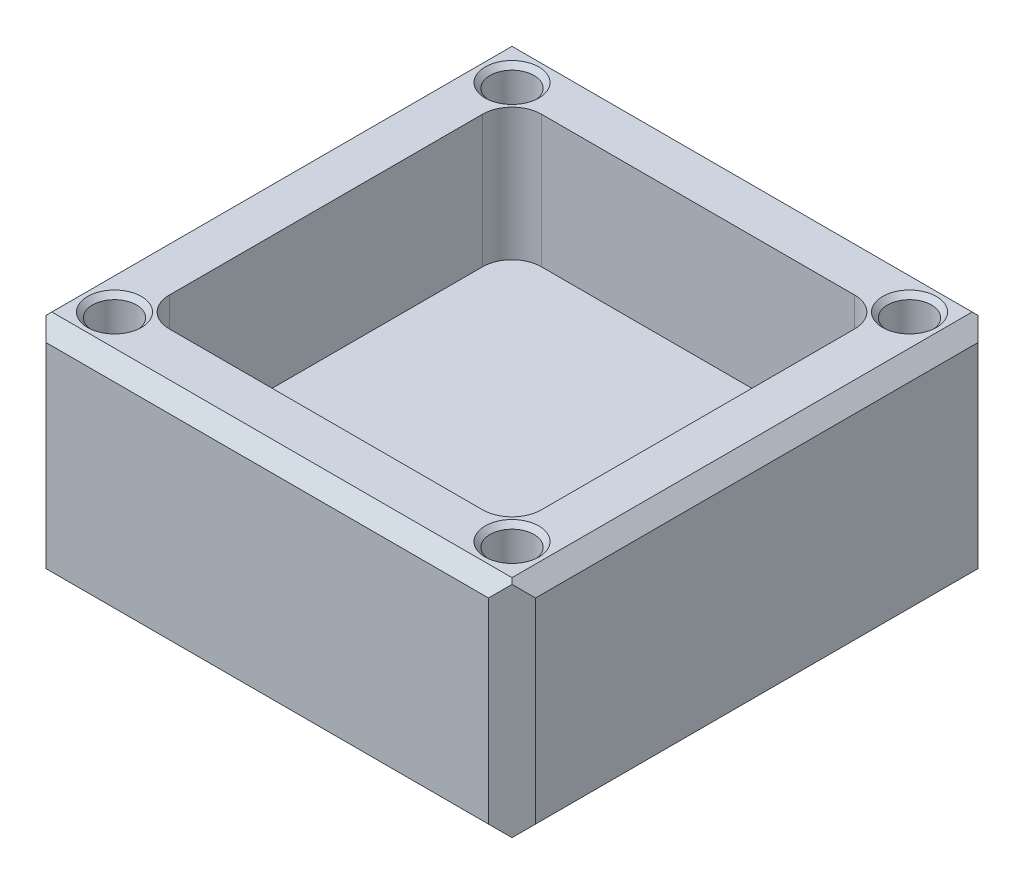
from build123d import *

# Parameters (mm, degrees)
BOSS_EXTRUDE1_DEPTH                          = 50
CUT_EXTRUDE1_DEPTH                           = 50
CUT_EXTRUDE2_DEPTH                           = 13.5
SKETCH4_R                                    = 2.25
CUT_EXTRUDE3_DEPTH                           = 18
CSK_FOR_M2_5_COUNTERSUNK_FLAT_HEAD_S_2_COUNT = 2
CSK_FOR_M2_5_COUNTERSUNK_FLAT_HEAD_S_2_PITCH = 40.6
CSK_FOR_M2_5_COUNTERSUNK_FLAT_HEAD_S_3_COUNT = 2
CSK_FOR_M2_5_COUNTERSUNK_FLAT_HEAD_S_3_PITCH = 57.417070632
CSK_FOR_M2_5_COUNTERSUNK_FLAT_HEAD_S_4_COUNT = 2
CSK_FOR_M2_5_COUNTERSUNK_FLAT_HEAD_S_4_PITCH = 40.6
CUT_EXTRUDE4_DEPTH                           = 76
SKETCH8_W                                    = 0.314102564
SKETCH8_H                                    = 3.58974359
SKETCH8_H_2                                  = 2.557692308
CUT_EXTRUDE5_DEPTH                           = 1


with BuildPart() as part:
    # Sketch1 → Boss-Extrude1 (new body)
    with BuildSketch(Plane.XY):
        Polygon((0, -21.5), (3.5, -25), (46.5, -25), (50, -21.5), (50, -1.5), (48.5, 0), (1.5, 0), (0, -1.5), align=None)
    extrude(amount=BOSS_EXTRUDE1_DEPTH)

    # Sketch2 → Cut-Extrude1 (cut)
    with BuildSketch(Plane.ZY):
        Polygon((48.5, 0), (50, -1.5), (50, 0), align=None)
        Polygon((50, -21.5), (46.5, -25), (50, -25), align=None)
        Polygon((1.5, 0), (0, 0), (0, -1.5), align=None)
        Polygon((3.5, -25), (0, -25), (0, -21.5), align=None)
    extrude(amount=-CUT_EXTRUDE1_DEPTH, mode=Mode.SUBTRACT)

    # Sketch3 → Cut-Extrude2 (cut)
    with BuildSketch(Plane(origin=(0, 0, 0), x_dir=(1, 0, 0), z_dir=(0, 1, 0))):
        with BuildLine():
            Line((9, -6), (41, -6))
            ThreePointArc((41, -6), (43.121320344, -6.878679656), (44, -9))
            Line((44, -9), (44, -41))
            ThreePointArc((44, -41), (43.121320344, -43.121320344), (41, -44))
            Line((41, -44), (9, -44))
            ThreePointArc((9, -44), (6.878679656, -43.121320344), (6, -41))
            Line((6, -41), (6, -9))
            ThreePointArc((6, -9), (6.878679656, -6.878679656), (9, -6))
        make_face()
    extrude(amount=-CUT_EXTRUDE2_DEPTH, mode=Mode.SUBTRACT)

    # Sketch4 → Cut-Extrude3 (cut)
    with BuildSketch(Plane(origin=(0, 0, 0), x_dir=(1, 0, 0), z_dir=(0, 1, 0))):
        with Locations(Location((4.7, -4.7, 0), (0, 0, 270))):
            Circle(SKETCH4_R)
        with Locations(Location((45.3, -4.7, 0), (0, 0, 270))):
            Circle(SKETCH4_R)
        with Locations(Location((45.3, -45.3, 0), (0, 0, 270))):
            Circle(SKETCH4_R)
        with Locations(Location((4.7, -45.3, 0), (0, 0, 270))):
            Circle(SKETCH4_R)
    extrude(amount=-CUT_EXTRUDE3_DEPTH, mode=Mode.SUBTRACT)

    # Sketch6 → CSK for M2.5 Countersunk Flat Head Screw1 (revolve, cut)
    with BuildSketch(Plane(origin=(4.7, 0, 4.7), x_dir=(0, 0, 1), z_dir=(1, 0, 0))):
        Polygon((0, 0), (0, 1.72), (1.45, 0.848752102), (1.45, 1.3), (2.75, 0), align=None)
    csk_for_m2_5_countersunk_flat_head_screw = revolve(axis=Axis((4.7, 6.35, 4.7), (0, -1, 0)), mode=Mode.SUBTRACT)

    # CSK for M2.5 Countersunk Flat Head S 2: CSK for M2.5 Countersunk Flat Head Screw1 ×2
    with Locations(*[(i * CSK_FOR_M2_5_COUNTERSUNK_FLAT_HEAD_S_2_PITCH, 0, 0) for i in range(1, CSK_FOR_M2_5_COUNTERSUNK_FLAT_HEAD_S_2_COUNT)]):
        add(csk_for_m2_5_countersunk_flat_head_screw, mode=Mode.SUBTRACT)

    # CSK for M2.5 Countersunk Flat Head S 3: CSK for M2.5 Countersunk Flat Head Screw1 ×2
    with Locations(*[Vector(0.7071067811865577, 0, 0.7071067811865374) * (i * CSK_FOR_M2_5_COUNTERSUNK_FLAT_HEAD_S_3_PITCH) for i in range(1, CSK_FOR_M2_5_COUNTERSUNK_FLAT_HEAD_S_3_COUNT)]):
        add(csk_for_m2_5_countersunk_flat_head_screw, mode=Mode.SUBTRACT)

    # CSK for M2.5 Countersunk Flat Head S 4: CSK for M2.5 Countersunk Flat Head Screw1 ×2
    with Locations(*[(0, 0, i * CSK_FOR_M2_5_COUNTERSUNK_FLAT_HEAD_S_4_PITCH) for i in range(1, CSK_FOR_M2_5_COUNTERSUNK_FLAT_HEAD_S_4_COUNT)]):
        add(csk_for_m2_5_countersunk_flat_head_screw, mode=Mode.SUBTRACT)

    # Sketch7 → Cut-Extrude4 (cut, through all)
    with BuildSketch(Plane(origin=(0, 0, 0), x_dir=(1, 0, 0), z_dir=(0, 1, 0))):
        Polygon((0, -2.404163056), (2.404163056, 0), (0, 0), align=None)
        Polygon((50, 0), (47.595836944, 0), (50, -2.404163056), align=None)
        Polygon((50, -50), (50, -47.595836944), (47.595836944, -50), align=None)
        Polygon((0, -50), (2.404163056, -50), (0, -47.595836944), align=None)
    extrude(amount=-CUT_EXTRUDE4_DEPTH, mode=Mode.SUBTRACT)

    # Sketch8 → Cut-Extrude5 (cut)
    # profile 1 of 15: a face of its own
    with BuildSketch(Plane.ZY):
        Polygon((9.352881005, -14), (9.352881005, -10.5), (9.418786453, -10.5), (11.731086133, -13.254707532), (11.731086133, -10.5), (12.045188697, -10.5), (12.045188697, -14), (11.973674274, -14), (9.666983569, -11.251602564), (9.666983569, -14), align=None)
    # profile 2 of 15: a face of its own
    with BuildSketch(Plane.ZY):
        with BuildLine():
            Line((15.455445107, -11.442307692), (15.455445107, -14))
            Line((15.455445107, -14), (15.141342543, -14))
            Line((15.141342543, -14), (15.141342543, -13.557592147))
            add(Edge.make_bspline(
                [(15.141342543, -13.557592147), (15.105923753, -13.597631741), (15.036803537, -13.675769512), (14.921362419, -13.777851685), (14.798994241, -13.862230007), (14.67029292, -13.930379922), (14.535374677, -13.981571979), (14.39453859, -14.017958138), (14.247727209, -14.041351973), (14.147474854, -14.043687995), (14.096671069, -14.044871795)],
                knots=[0, 0, 0, 0, 1.074387032, 2.096679803, 3.090159297, 4.057316773, 5.018401886, 5.985159533, 6.978961417, 8, 8, 8, 8], degree=3))
            add(Edge.make_bspline(
                [(14.096671069, -14.044871795), (14.051503115, -14.043645423), (13.96242991, -14.041226962), (13.831400833, -14.022464659), (13.705308584, -13.992334037), (13.584034011, -13.950433147), (13.468361865, -13.894852326), (13.357301769, -13.828311078), (13.251429077, -13.749070248), (13.152357538, -13.658482219), (13.061125537, -13.560087232), (12.981064265, -13.455141685), (12.914311185, -13.344099381), (12.858491104, -13.228366227), (12.81549476, -13.107051308), (12.785521126, -12.98057414), (12.766780679, -12.849084266), (12.764363218, -12.759544743), (12.763137415, -12.714142628)],
                knots=[0, 0, 0, 0, 1.033919861, 2.038935746, 3.024066025, 3.998881131, 4.97069526, 5.957263378, 6.95902576, 7.993208707, 9.027059324, 10.027763471, 11.009749337, 11.988697705, 12.965288445, 13.950418724, 14.960734635, 16, 16, 16, 16], degree=3))
            add(Edge.make_bspline(
                [(12.763137415, -12.714142628), (12.764390386, -12.669678925), (12.766867443, -12.581776581), (12.785320663, -12.452497883), (12.816351672, -12.327979623), (12.859899519, -12.208622679), (12.915741474, -12.094282629), (12.983669561, -11.984878604), (13.063688686, -11.880109207), (13.155941093, -11.78243798), (13.255875863, -11.692217366), (13.362784594, -11.61380832), (13.474007875, -11.546091471), (13.591270886, -11.492437995), (13.712837991, -11.449028891), (13.839791437, -11.418995922), (13.971603015, -11.401298601), (14.061093507, -11.398735837), (14.106486774, -11.397435897)],
                knots=[0, 0, 0, 0, 1.020392517, 2.01726096, 2.990465484, 3.961182959, 4.928053699, 5.906110375, 6.912531644, 7.948652711, 8.985773172, 9.998621852, 10.987621588, 11.969261332, 12.953316658, 13.946091881, 14.958173133, 16, 16, 16, 16], degree=3))
            add(Edge.make_bspline(
                [(14.106486774, -11.397435897), (14.158686633, -11.398873649), (14.261048093, -11.401693012), (14.410776102, -11.425155739), (14.55242058, -11.464794206), (14.687074932, -11.518711704), (14.814255618, -11.590360433), (14.932758603, -11.680740395), (15.043824086, -11.789281581), (15.108204378, -11.872652026), (15.141342543, -11.915564904)],
                knots=[0, 0, 0, 0, 1.038897134, 2.037228247, 3.008116434, 3.962042015, 4.918381754, 5.904844433, 6.921570401, 8, 8, 8, 8], degree=3))
            Line((15.141342543, -11.915564904), (15.141342543, -11.442307692))
            Line((15.141342543, -11.442307692), (15.455445107, -11.442307692))
        make_face()
        with BuildLine():
            add(Edge.make_bspline(
                [(14.110693505, -11.711538462), (14.064779167, -11.713172099), (13.974151567, -11.71639664), (13.841107565, -11.741570135), (13.713794151, -11.78345473), (13.592848076, -11.840736631), (13.48017986, -11.912765368), (13.379486189, -11.999886751), (13.289943488, -12.099723765), (13.214635223, -12.211825875), (13.153244727, -12.332003967), (13.110077695, -12.457628405), (13.081608447, -12.586433382), (13.078699927, -12.673796068), (13.077239979, -12.717648237)],
                knots=[0, 0, 0, 0, 1.031046209, 2.035121221, 3.029706178, 4.034933723, 5.034054252, 6.02443088, 7.017295772, 8.038157696, 9.050218397, 10.03989886, 11.016116709, 12, 12, 12, 12], degree=3))
            add(Edge.make_bspline(
                [(13.077239979, -12.717648237), (13.079104872, -12.761238344), (13.082827349, -12.8482477), (13.109578044, -12.977228277), (13.154457917, -13.102882319), (13.21569998, -13.224143313), (13.292386605, -13.336727413), (13.381275257, -13.438467536), (13.483225538, -13.525957124), (13.596153046, -13.599194697), (13.716761016, -13.658357218), (13.843594947, -13.699522858), (13.974270586, -13.726100638), (14.063122919, -13.729205115), (14.107889018, -13.730769231)],
                knots=[0, 0, 0, 0, 0.979072187, 1.954306742, 2.945804271, 3.96968567, 4.997920485, 5.998718438, 6.996577872, 8.005894225, 9.015743152, 10.005417472, 10.995077863, 12, 12, 12, 12], degree=3))
            add(Edge.make_bspline(
                [(14.107889018, -13.730769231), (14.15333552, -13.729109267), (14.243724107, -13.725807763), (14.377162815, -13.700526498), (14.506657778, -13.6587577), (14.630445006, -13.600858573), (14.745761137, -13.529101217), (14.849259015, -13.445094126), (14.936774983, -13.347390942), (15.010967593, -13.240014489), (15.069143009, -13.122302492), (15.111519069, -12.996968302), (15.136572974, -12.864007553), (15.139730704, -12.773143626), (15.141342543, -12.726762821)],
                knots=[0, 0, 0, 0, 1.01762866, 2.023962475, 3.030623092, 4.058876274, 5.077231937, 6.066672613, 7.034107872, 8.005628644, 8.981990164, 9.965428785, 10.961468474, 12, 12, 12, 12], degree=3))
            add(Edge.make_bspline(
                [(15.141342543, -12.726762821), (15.140382887, -12.69142499), (15.138493979, -12.621868957), (15.12406341, -12.519741439), (15.101108483, -12.422007713), (15.068762313, -12.328565024), (15.026271029, -12.239930009), (14.975023263, -12.155466248), (14.914117813, -12.075613037), (14.844535117, -12.001469966), (14.768369915, -11.933843504), (14.687775374, -11.873479263), (14.601796627, -11.82389049), (14.51187959, -11.782849219), (14.417868256, -11.750190069), (14.318997636, -11.728402375), (14.216318649, -11.713442054), (14.146272594, -11.712179673), (14.110693505, -11.711538462)],
                knots=[0, 0, 0, 0, 1.050140795, 2.067009409, 3.05949893, 4.030605086, 5.00011959, 5.97591094, 6.962425594, 7.979863591, 8.993523472, 9.986985069, 10.967611495, 11.937549037, 12.921786183, 13.919465291, 14.943216303, 16, 16, 16, 16], degree=3))
        make_face(mode=Mode.SUBTRACT)
    # profile 3 of 15: a face of its own
    with BuildSketch(Plane.ZY):
        with BuildLine():
            Line((16.173393825, -11.442307692), (16.487496389, -11.442307692))
            Line((16.487496389, -11.442307692), (16.487496389, -11.915564904))
            add(Edge.make_bspline(
                [(16.487496389, -11.915564904), (16.520853873, -11.87262717), (16.585677468, -11.789186277), (16.697402373, -11.681196149), (16.815329182, -11.590120845), (16.942492594, -11.518738312), (17.076916284, -11.4649175), (17.218048602, -11.42513805), (17.367087367, -11.401696576), (17.468983819, -11.398874914), (17.520949915, -11.397435897)],
                knots=[0, 0, 0, 0, 1.0828784, 2.104357462, 3.088488658, 4.04616522, 5.001424249, 5.969181776, 6.964304535, 8, 8, 8, 8], degree=3))
            add(Edge.make_bspline(
                [(17.520949915, -11.397435897), (17.566341518, -11.398749076), (17.656060407, -11.401344643), (17.788123635, -11.418917698), (17.915299019, -11.44903539), (18.036867073, -11.492436306), (18.154130138, -11.546091776), (18.265352238, -11.613808811), (18.372265794, -11.692215002), (18.472181983, -11.782447153), (18.56450335, -11.880075419), (18.644349531, -11.985097723), (18.713221436, -12.09406031), (18.768891732, -12.208652402), (18.81250008, -12.327971632), (18.843514757, -12.452500073), (18.861972401, -12.581776013), (18.864448852, -12.669678734), (18.865701518, -12.714142628)],
                knots=[0, 0, 0, 0, 1.041296284, 2.058176809, 3.050446431, 4.034000596, 5.01514041, 6.003636468, 7.015969324, 8.052561599, 9.08815499, 10.094063707, 11.074456064, 12.040834395, 13.011057502, 13.983766392, 14.980127149, 16, 16, 16, 16], degree=3))
            add(Edge.make_bspline(
                [(18.865701518, -12.714142628), (18.864476032, -12.759544937), (18.862059198, -12.849084841), (18.843314192, -12.980571938), (18.813357318, -13.107059312), (18.770299134, -13.228336576), (18.714657646, -13.344320227), (18.646953086, -13.454926623), (18.567066619, -13.560120326), (18.475765491, -13.658473226), (18.376712555, -13.749072539), (18.270835065, -13.828310609), (18.15977614, -13.894851984), (18.044103973, -13.950434944), (17.922828334, -13.992327128), (17.796515056, -14.022544929), (17.66523291, -14.041179424), (17.575931758, -14.043631567), (17.53076562, -14.044871795)],
                knots=[0, 0, 0, 0, 1.038740735, 2.04854663, 3.033179607, 4.009277356, 4.987731542, 5.972001279, 6.972200261, 8.005528982, 9.039189865, 10.040446548, 11.026516639, 11.997840187, 12.972163198, 13.956796175, 14.96660207, 16, 16, 16, 16], degree=3))
            add(Edge.make_bspline(
                [(17.53076562, -14.044871795), (17.479938048, -14.043576987), (17.379538692, -14.041019362), (17.232741022, -14.015099952), (17.09146417, -13.976363017), (16.957273345, -13.919664023), (16.829105533, -13.847408507), (16.707685727, -13.759298301), (16.592368974, -13.655517676), (16.522960217, -13.57678586), (16.487496389, -13.536558494)],
                knots=[0, 0, 0, 0, 1.014726462, 2.004382257, 2.969841629, 3.936926163, 4.907207904, 5.903978561, 6.929055279, 8, 8, 8, 8], degree=3))
            Line((16.487496389, -13.536558494), (16.487496389, -14.942307692))
            Line((16.487496389, -14.942307692), (16.173393825, -14.942307692))
            Line((16.173393825, -14.942307692), (16.173393825, -11.442307692))
        make_face()
        with BuildLine():
            add(Edge.make_bspline(
                [(17.518145428, -11.711538462), (17.482565865, -11.71217872), (17.412518878, -11.713439223), (17.309846659, -11.728413172), (17.210951231, -11.750150913), (17.116829279, -11.783062813), (17.026578663, -11.823461627), (16.940894498, -11.873943638), (16.859836931, -11.933595644), (16.7836099, -12.001274987), (16.714746607, -12.075849676), (16.653783679, -12.155437485), (16.602576374, -12.239937624), (16.560074353, -12.328562987), (16.527731071, -12.422008272), (16.504775351, -12.519741285), (16.490344998, -12.621868997), (16.488456061, -12.691425004), (16.487496389, -12.726762821)],
                knots=[0, 0, 0, 0, 1.05670511, 2.080379991, 3.077984906, 4.06214886, 5.038337365, 6.01289324, 7.01187578, 8.025460281, 9.038092164, 10.024533457, 11.000252242, 11.969694649, 12.940728589, 13.933144304, 14.949937299, 16, 16, 16, 16], degree=3))
            add(Edge.make_bspline(
                [(16.487496389, -12.726762821), (16.489087245, -12.773150933), (16.492203867, -12.864029174), (16.517541235, -12.996813296), (16.558776499, -13.122464952), (16.617305213, -13.239925989), (16.691252787, -13.347908824), (16.780350944, -13.44459943), (16.883793495, -13.529390021), (16.999860686, -13.600811275), (17.124282817, -13.658799341), (17.254068729, -13.700313552), (17.38743361, -13.72588578), (17.47760193, -13.729132599), (17.52305328, -13.730769231)],
                knots=[0, 0, 0, 0, 1.03728447, 2.032128127, 3.01272805, 3.987917167, 4.958271349, 5.931593992, 6.91984656, 7.941419022, 8.973179163, 9.983609215, 10.983593296, 12, 12, 12, 12], degree=3))
            add(Edge.make_bspline(
                [(17.52305328, -13.730769231), (17.567589048, -13.729212854), (17.655984541, -13.726123726), (17.786142663, -13.699385538), (17.912633301, -13.658540513), (18.032813474, -13.598980957), (18.145636961, -13.525990899), (18.247518515, -13.438430866), (18.336525429, -13.336940923), (18.412389784, -13.22393242), (18.473521269, -13.102757036), (18.519451509, -12.977375647), (18.545960082, -12.848230224), (18.549716871, -12.761232511), (18.551598953, -12.717648237)],
                knots=[0, 0, 0, 0, 1.00104056, 1.986885549, 2.97790532, 3.984399681, 4.995088187, 5.994304198, 6.996462723, 8.023150851, 9.048424203, 10.043036403, 11.019596776, 12, 12, 12, 12], degree=3))
            add(Edge.make_bspline(
                [(18.551598953, -12.717648237), (18.55014422, -12.673793248), (18.547246086, -12.586424944), (18.518699048, -12.457662041), (18.47579907, -12.331774065), (18.413240018, -12.212253516), (18.339038749, -12.099479433), (18.249291752, -11.999925554), (18.148675556, -11.912754881), (18.035986392, -11.840739471), (17.915045966, -11.783453976), (17.78773105, -11.741570337), (17.654687448, -11.716396588), (17.564059793, -11.713172082), (17.518145428, -11.711538462)],
                knots=[0, 0, 0, 0, 0.983928682, 1.960191568, 2.949917689, 3.96440592, 4.982380491, 5.975291189, 6.965713506, 7.964880129, 8.970154049, 9.96478489, 10.968906225, 12, 12, 12, 12], degree=3))
        make_face(mode=Mode.SUBTRACT)
    # profile 4 of 15: a face of its own
    with BuildSketch(Plane.ZY):
        with BuildLine():
            add(Edge.make_bspline(
                [(20.729283248, -11.397435897), (20.777274521, -11.398457789), (20.871373679, -11.400461467), (21.009181565, -11.421876433), (21.140726701, -11.454623797), (21.266512893, -11.499895359), (21.384929188, -11.56057731), (21.497700432, -11.632986601), (21.604517441, -11.718769195), (21.66854047, -11.785127263), (21.701038056, -11.818810096)],
                knots=[0, 0, 0, 0, 1.054011418, 2.066658804, 3.057071809, 4.030435133, 4.997543892, 5.974964718, 6.972108034, 8, 8, 8, 8], degree=3))
            add(Edge.make_bspline(
                [(21.701038056, -11.818810096), (21.72902001, -11.851024082), (21.78444239, -11.914828624), (21.855508109, -12.018284237), (21.916729669, -12.125424338), (21.96579263, -12.237671664), (22.004477654, -12.354046336), (22.03194335, -12.474948347), (22.048280285, -12.600110694), (22.050483252, -12.685114532), (22.051598953, -12.728165064)],
                knots=[0, 0, 0, 0, 1.025258237, 2.030674902, 3.01204498, 3.988269485, 4.97094183, 5.956517959, 6.965070386, 8, 8, 8, 8], degree=3))
            add(Edge.make_bspline(
                [(22.051598953, -12.728165064), (22.050617616, -12.771465122), (22.048678448, -12.857028055), (22.030334831, -12.983047421), (22.001803746, -13.105242244), (21.960971907, -13.223100937), (21.908613798, -13.336983765), (21.844723111, -13.446393314), (21.768851493, -13.551545447), (21.682847497, -13.651547286), (21.587795621, -13.7437135), (21.484679472, -13.82404177), (21.375525438, -13.892863294), (21.258882085, -13.94829971), (21.135814598, -13.99200941), (21.00605753, -14.022709427), (20.86981246, -14.04127111), (20.776785239, -14.043654684), (20.729283248, -14.044871795)],
                knots=[0, 0, 0, 0, 0.998656419, 1.973391657, 2.932242238, 3.890759089, 4.846373663, 5.82037756, 6.809684879, 7.83454468, 8.860553229, 9.859544525, 10.845671541, 11.83227036, 12.833544569, 13.85385346, 14.904124723, 16, 16, 16, 16], degree=3))
            add(Edge.make_bspline(
                [(20.729283248, -14.044871795), (20.681548529, -14.043650599), (20.588057669, -14.041258824), (20.451331687, -14.022781541), (20.321342068, -13.992023559), (20.19811347, -13.948156066), (20.080968623, -13.892861522), (19.971182126, -13.824249833), (19.86798221, -13.743689678), (19.772910226, -13.651553741), (19.686911621, -13.551543784), (19.611038612, -13.446393746), (19.547148286, -13.336983652), (19.494790082, -13.223100967), (19.453958269, -13.105242236), (19.425427177, -12.983047423), (19.407083562, -12.857028055), (19.405144393, -12.771465122), (19.404163056, -12.728165064)],
                knots=[0, 0, 0, 0, 1.099876186, 2.154163076, 3.173186993, 4.173200201, 5.163417411, 6.152872554, 7.150605724, 8.17532212, 9.198891216, 10.186952605, 11.159729845, 12.11414092, 13.071450619, 14.029093627, 15.002601286, 16, 16, 16, 16], degree=3))
            add(Edge.make_bspline(
                [(19.404163056, -12.728165064), (19.405286366, -12.685348518), (19.407510328, -12.600579116), (19.423830837, -12.475652055), (19.451189393, -12.354954666), (19.48992079, -12.23902919), (19.539435981, -12.127273754), (19.599797269, -12.019868923), (19.671587901, -11.916881123), (19.726789853, -11.853159043), (19.754723953, -11.820913462)],
                knots=[0, 0, 0, 0, 1.031353054, 2.041901799, 3.029428768, 4.008703097, 4.981709435, 5.96992636, 6.972712378, 8, 8, 8, 8], degree=3))
            add(Edge.make_bspline(
                [(19.754723953, -11.820913462), (19.787172544, -11.786938522), (19.850988408, -11.720120826), (19.958337136, -11.634588302), (20.070830957, -11.560672228), (20.190555883, -11.501196013), (20.316238741, -11.454357495), (20.448457984, -11.42179198), (20.586733499, -11.400538625), (20.68129312, -11.398480447), (20.729283248, -11.397435897)],
                knots=[0, 0, 0, 0, 1.027980169, 2.021703884, 2.998553061, 3.971491411, 4.943284454, 5.930300938, 6.949603206, 8, 8, 8, 8], degree=3))
        make_face()
        with BuildLine():
            add(Edge.make_bspline(
                [(20.727881005, -11.711538462), (20.693943393, -11.712503053), (20.626944265, -11.714407336), (20.52832468, -11.72889124), (20.433384526, -11.751838745), (20.341943682, -11.784442801), (20.25431051, -11.8265417), (20.170401107, -11.87825006), (20.089968667, -11.938883016), (20.014586604, -12.008345688), (19.945404292, -12.084224683), (19.884926315, -12.165073041), (19.833501209, -12.249579388), (19.79066105, -12.337831599), (19.758753862, -12.430724013), (19.735580839, -12.527204644), (19.721110599, -12.62747006), (19.71922422, -12.695631079), (19.71826562, -12.730268429)],
                knots=[0, 0, 0, 0, 1.021534396, 2.016698045, 2.994645724, 3.958388632, 4.93408049, 5.916473867, 6.921342795, 7.962252576, 8.998418191, 10.008913653, 10.997312074, 11.973003931, 12.956656626, 13.948281152, 14.957379055, 16, 16, 16, 16], degree=3))
            add(Edge.make_bspline(
                [(19.71826562, -12.730268429), (19.719872444, -12.775020457), (19.723061688, -12.863844862), (19.748996925, -12.994655985), (19.792383205, -13.120237837), (19.850970484, -13.239854223), (19.924376703, -13.350526501), (20.01086377, -13.449197985), (20.10950347, -13.534383797), (20.21911997, -13.605064642), (20.337474288, -13.661224398), (20.462730609, -13.701023374), (20.593371303, -13.726895066), (20.682652034, -13.729466541), (20.727881005, -13.730769231)],
                knots=[0, 0, 0, 0, 1.016792936, 2.018143844, 3.017858371, 4.030088057, 5.03801393, 6.028138512, 7.003788237, 7.991172063, 8.984598303, 9.972568034, 10.972917682, 12, 12, 12, 12], degree=3))
            add(Edge.make_bspline(
                [(20.727881005, -13.730769231), (20.773107374, -13.729458951), (20.86238297, -13.726872494), (20.992842146, -13.701153674), (21.117756118, -13.661050013), (21.235987506, -13.605127803), (21.345554109, -13.534115389), (21.444903231, -13.449679012), (21.530651842, -13.35026516), (21.603985447, -13.239707631), (21.663532189, -13.120423279), (21.706715391, -12.994632807), (21.732712977, -12.863850765), (21.735893806, -12.775022434), (21.737496389, -12.730268429)],
                knots=[0, 0, 0, 0, 1.02726834, 2.027799167, 3.010890988, 4.004497153, 4.992059811, 5.971914811, 6.958719428, 7.966827853, 8.981595046, 9.981490638, 10.983022906, 12, 12, 12, 12], degree=3))
            add(Edge.make_bspline(
                [(21.737496389, -12.730268429), (21.736538119, -12.695630872), (21.73465239, -12.627469446), (21.720177426, -12.527206993), (21.697021886, -12.430715396), (21.665050269, -12.337863393), (21.622396255, -12.249350888), (21.569979462, -12.165321161), (21.509748437, -12.083944615), (21.439731316, -12.008590974), (21.364427938, -11.938855938), (21.2839629, -11.878226548), (21.200177921, -11.826768953), (21.112799338, -11.784082712), (21.021346771, -11.752135372), (20.926539642, -11.728758741), (20.828340832, -11.714468544), (20.761581788, -11.712521402), (20.727881005, -11.711538462)],
                knots=[0, 0, 0, 0, 1.042956736, 2.052379634, 3.044323526, 4.02829302, 5.004299113, 5.996692471, 7.007513377, 8.048758398, 9.090003419, 10.095195979, 11.07790575, 12.047570684, 13.018257071, 13.989683339, 14.985167495, 16, 16, 16, 16], degree=3))
        make_face(mode=Mode.SUBTRACT)
    # profile 5 of 15: a face of its own
    with BuildSketch(Plane.ZY):
        with Locations((22.791983569, -12.205128205)):
            Rectangle(SKETCH8_W, SKETCH8_H)
    # profile 6 of 15: a face of its own
    with BuildSketch(Plane.ZY):
        with BuildLine():
            add(Edge.make_bspline(
                [(23.777760812, -10.365384615), (23.797252128, -10.366288768), (23.835419868, -10.368059272), (23.890613136, -10.383220749), (23.940870148, -10.408920434), (23.985447881, -10.443400115), (24.023699767, -10.483949559), (24.050480478, -10.531210527), (24.067692874, -10.582269166), (24.069771429, -10.617884255), (24.070829723, -10.636017628)],
                knots=[0, 0, 0, 0, 1.055194115, 2.066272739, 3.074728998, 4.095836921, 5.109056067, 6.073838105, 7.019297344, 8, 8, 8, 8], degree=3))
            add(Edge.make_bspline(
                [(24.070829723, -10.636017628), (24.069747563, -10.653680281), (24.067608261, -10.688597256), (24.050493773, -10.738770728), (24.023471535, -10.785375012), (23.985472409, -10.825845722), (23.940863648, -10.860306342), (23.890614862, -10.886011081), (23.835419414, -10.901171218), (23.797251975, -10.902941907), (23.777760812, -10.903846154)],
                knots=[0, 0, 0, 0, 0.96129708, 1.900370562, 2.859976407, 3.87933698, 4.906634145, 5.921202961, 6.938410037, 8, 8, 8, 8], degree=3))
            add(Edge.make_bspline(
                [(23.777760812, -10.903846154), (23.758492537, -10.902976434), (23.720989357, -10.901283637), (23.666622515, -10.885713619), (23.616794025, -10.860297546), (23.572129353, -10.826071361), (23.53489916, -10.785126464), (23.507800834, -10.73879917), (23.490725872, -10.688590015), (23.488581244, -10.653677849), (23.487496389, -10.636017628)],
                knots=[0, 0, 0, 0, 1.054934014, 2.053291228, 3.073705704, 4.106921865, 5.123545215, 6.088680038, 7.033164197, 8, 8, 8, 8], degree=3))
            add(Edge.make_bspline(
                [(23.487496389, -10.636017628), (23.488557476, -10.617886779), (23.490641517, -10.582276646), (23.507813633, -10.531181613), (23.534673441, -10.484200111), (23.572154004, -10.443174612), (23.616787465, -10.408929177), (23.66662421, -10.383518196), (23.720988909, -10.367946856), (23.758492385, -10.366254242), (23.777760812, -10.365384615)],
                knots=[0, 0, 0, 0, 0.98631895, 1.937192651, 2.907499808, 3.917963147, 4.944918757, 5.95915025, 6.951458133, 8, 8, 8, 8], degree=3))
        make_face()
    # profile 7 of 15: a face of its own
    with BuildSketch(Plane.ZY):
        with Locations((23.779163056, -12.721153846)):
            Rectangle(SKETCH8_W, SKETCH8_H_2)
    # profile 8 of 15: a face of its own
    with BuildSketch(Plane.ZY):
        Polygon((25.013137415, -10.41025641), (25.327239979, -10.41025641), (25.327239979, -11.442307692), (25.775957928, -11.442307692), (25.775957928, -11.756410256), (25.327239979, -11.756410256), (25.327239979, -14), (25.013137415, -14), (25.013137415, -11.756410256), (24.564419466, -11.756410256), (24.564419466, -11.442307692), (25.013137415, -11.442307692), align=None)
    # profile 9 of 15: a face of its own
    with BuildSketch(Plane.ZY):
        with BuildLine():
            Line((28.916983569, -11.442307692), (28.916983569, -14))
            Line((28.916983569, -14), (28.602881005, -14))
            Line((28.602881005, -14), (28.602881005, -13.557592147))
            add(Edge.make_bspline(
                [(28.602881005, -13.557592147), (28.567462214, -13.597631741), (28.498341999, -13.675769512), (28.382900881, -13.777851685), (28.260532703, -13.862230007), (28.131831382, -13.930379922), (27.996913138, -13.981571979), (27.856077051, -14.017958138), (27.70926567, -14.041351973), (27.609013316, -14.043687995), (27.55820953, -14.044871795)],
                knots=[0, 0, 0, 0, 1.074387032, 2.096679803, 3.090159297, 4.057316773, 5.018401886, 5.985159533, 6.978961417, 8, 8, 8, 8], degree=3))
            add(Edge.make_bspline(
                [(27.55820953, -14.044871795), (27.513041577, -14.043645423), (27.423968372, -14.041226962), (27.292939295, -14.022464659), (27.166847045, -13.992334037), (27.045572472, -13.950433147), (26.929900327, -13.894852326), (26.81884023, -13.828311078), (26.712967538, -13.749070248), (26.613895999, -13.658482219), (26.522663999, -13.560087232), (26.442602726, -13.455141685), (26.375849646, -13.344099381), (26.320029566, -13.228366227), (26.277033221, -13.107051308), (26.247059587, -12.98057414), (26.22831914, -12.849084266), (26.22590168, -12.759544743), (26.224675877, -12.714142628)],
                knots=[0, 0, 0, 0, 1.033919861, 2.038935746, 3.024066025, 3.998881131, 4.97069526, 5.957263378, 6.95902576, 7.993208707, 9.027059324, 10.027763471, 11.009749337, 11.988697705, 12.965288445, 13.950418724, 14.960734635, 16, 16, 16, 16], degree=3))
            add(Edge.make_bspline(
                [(26.224675877, -12.714142628), (26.225928848, -12.669678925), (26.228405905, -12.581776581), (26.246859125, -12.452497883), (26.277890133, -12.327979623), (26.321437981, -12.208622679), (26.377279936, -12.094282629), (26.445208023, -11.984878604), (26.525227148, -11.880109207), (26.617479555, -11.78243798), (26.717414325, -11.692217366), (26.824323056, -11.61380832), (26.935546337, -11.546091471), (27.052809348, -11.492437995), (27.174376452, -11.449028891), (27.301329898, -11.418995922), (27.433141477, -11.401298601), (27.522631969, -11.398735837), (27.568025236, -11.397435897)],
                knots=[0, 0, 0, 0, 1.020392517, 2.01726096, 2.990465484, 3.961182959, 4.928053699, 5.906110375, 6.912531644, 7.948652711, 8.985773172, 9.998621852, 10.987621588, 11.969261332, 12.953316658, 13.946091881, 14.958173133, 16, 16, 16, 16], degree=3))
            add(Edge.make_bspline(
                [(27.568025236, -11.397435897), (27.620225095, -11.398873649), (27.722586555, -11.401693012), (27.872314564, -11.425155739), (28.013959042, -11.464794206), (28.148613394, -11.518711704), (28.27579408, -11.590360433), (28.394297064, -11.680740395), (28.505362547, -11.789281581), (28.569742839, -11.872652026), (28.602881005, -11.915564904)],
                knots=[0, 0, 0, 0, 1.038897134, 2.037228247, 3.008116434, 3.962042015, 4.918381754, 5.904844433, 6.921570401, 8, 8, 8, 8], degree=3))
            Line((28.602881005, -11.915564904), (28.602881005, -11.442307692))
            Line((28.602881005, -11.442307692), (28.916983569, -11.442307692))
        make_face()
        with BuildLine():
            add(Edge.make_bspline(
                [(27.572231966, -11.711538462), (27.526317628, -11.713172099), (27.435690028, -11.71639664), (27.302646026, -11.741570135), (27.175332612, -11.78345473), (27.054386538, -11.840736631), (26.941718321, -11.912765368), (26.841024651, -11.999886751), (26.751481949, -12.099723765), (26.676173685, -12.211825875), (26.614783188, -12.332003967), (26.571616156, -12.457628405), (26.543146909, -12.586433382), (26.540238388, -12.673796068), (26.538778441, -12.717648237)],
                knots=[0, 0, 0, 0, 1.031046209, 2.035121221, 3.029706178, 4.034933723, 5.034054252, 6.02443088, 7.017295772, 8.038157696, 9.050218397, 10.03989886, 11.016116709, 12, 12, 12, 12], degree=3))
            add(Edge.make_bspline(
                [(26.538778441, -12.717648237), (26.540643334, -12.761238344), (26.544365811, -12.8482477), (26.571116505, -12.977228277), (26.615996379, -13.102882319), (26.677238441, -13.224143313), (26.753925066, -13.336727413), (26.842813719, -13.438467536), (26.944764, -13.525957124), (27.057691507, -13.599194697), (27.178299477, -13.658357218), (27.305133409, -13.699522858), (27.435809047, -13.726100638), (27.524661381, -13.729205115), (27.569427479, -13.730769231)],
                knots=[0, 0, 0, 0, 0.979072187, 1.954306742, 2.945804271, 3.96968567, 4.997920485, 5.998718438, 6.996577872, 8.005894225, 9.015743152, 10.005417472, 10.995077863, 12, 12, 12, 12], degree=3))
            add(Edge.make_bspline(
                [(27.569427479, -13.730769231), (27.614873982, -13.729109267), (27.705262568, -13.725807763), (27.838701276, -13.700526498), (27.968196239, -13.6587577), (28.091983467, -13.600858573), (28.207299599, -13.529101217), (28.310797476, -13.445094126), (28.398313445, -13.347390942), (28.472506054, -13.240014489), (28.530681471, -13.122302492), (28.57305753, -12.996968302), (28.598111436, -12.864007553), (28.601269165, -12.773143626), (28.602881005, -12.726762821)],
                knots=[0, 0, 0, 0, 1.01762866, 2.023962475, 3.030623092, 4.058876274, 5.077231937, 6.066672613, 7.034107872, 8.005628644, 8.981990164, 9.965428785, 10.961468474, 12, 12, 12, 12], degree=3))
            add(Edge.make_bspline(
                [(28.602881005, -12.726762821), (28.601921348, -12.69142499), (28.600032441, -12.621868957), (28.585601871, -12.519741439), (28.562646945, -12.422007713), (28.530300775, -12.328565024), (28.487809491, -12.239930009), (28.436561725, -12.155466248), (28.375656275, -12.075613037), (28.306073579, -12.001469966), (28.229908376, -11.933843504), (28.149313836, -11.873479263), (28.063335089, -11.82389049), (27.973418052, -11.782849219), (27.879406717, -11.750190069), (27.780536098, -11.728402375), (27.677857111, -11.713442054), (27.607811055, -11.712179673), (27.572231966, -11.711538462)],
                knots=[0, 0, 0, 0, 1.050140795, 2.067009409, 3.05949893, 4.030605086, 5.00011959, 5.97591094, 6.962425594, 7.979863591, 8.993523472, 9.986985069, 10.967611495, 11.937549037, 12.921786183, 13.919465291, 14.943216303, 16, 16, 16, 16], degree=3))
        make_face(mode=Mode.SUBTRACT)
    # profile 10 of 15: a face of its own
    with BuildSketch(Plane.ZY):
        with BuildLine():
            Line((32.237496389, -11.442307692), (32.237496389, -14))
            Line((32.237496389, -14), (31.923393825, -14))
            Line((31.923393825, -14), (31.923393825, -13.557592147))
            add(Edge.make_bspline(
                [(31.923393825, -13.557592147), (31.887975035, -13.597631741), (31.818854819, -13.675769512), (31.703413701, -13.777851685), (31.581045523, -13.862230007), (31.452344202, -13.930379922), (31.317425959, -13.981571979), (31.176589872, -14.017958138), (31.029778491, -14.041351973), (30.929526136, -14.043687995), (30.878722351, -14.044871795)],
                knots=[0, 0, 0, 0, 1.074387032, 2.096679803, 3.090159297, 4.057316773, 5.018401886, 5.985159533, 6.978961417, 8, 8, 8, 8], degree=3))
            add(Edge.make_bspline(
                [(30.878722351, -14.044871795), (30.833554397, -14.043645423), (30.744481192, -14.041226962), (30.613452115, -14.022464659), (30.487359866, -13.992334037), (30.366085293, -13.950433147), (30.250413147, -13.894852326), (30.139353051, -13.828311078), (30.033480359, -13.749070248), (29.93440882, -13.658482219), (29.843176819, -13.560087232), (29.763115547, -13.455141685), (29.696362467, -13.344099381), (29.640542386, -13.228366227), (29.597546042, -13.107051308), (29.567572408, -12.98057414), (29.548831961, -12.849084266), (29.5464145, -12.759544743), (29.545188697, -12.714142628)],
                knots=[0, 0, 0, 0, 1.033919861, 2.038935746, 3.024066025, 3.998881131, 4.97069526, 5.957263378, 6.95902576, 7.993208707, 9.027059324, 10.027763471, 11.009749337, 11.988697705, 12.965288445, 13.950418724, 14.960734635, 16, 16, 16, 16], degree=3))
            add(Edge.make_bspline(
                [(29.545188697, -12.714142628), (29.546441668, -12.669678925), (29.548918725, -12.581776581), (29.567371945, -12.452497883), (29.598402954, -12.327979623), (29.641950801, -12.208622679), (29.697792756, -12.094282629), (29.765720843, -11.984878604), (29.845739968, -11.880109207), (29.937992375, -11.78243798), (30.037927145, -11.692217366), (30.144835876, -11.61380832), (30.256059158, -11.546091471), (30.373322168, -11.492437995), (30.494889273, -11.449028891), (30.621842719, -11.418995922), (30.753654297, -11.401298601), (30.843144789, -11.398735837), (30.888538056, -11.397435897)],
                knots=[0, 0, 0, 0, 1.020392517, 2.01726096, 2.990465484, 3.961182959, 4.928053699, 5.906110375, 6.912531644, 7.948652711, 8.985773172, 9.998621852, 10.987621588, 11.969261332, 12.953316658, 13.946091881, 14.958173133, 16, 16, 16, 16], degree=3))
            add(Edge.make_bspline(
                [(30.888538056, -11.397435897), (30.940737915, -11.398873649), (31.043099375, -11.401693012), (31.192827384, -11.425155739), (31.334471862, -11.464794206), (31.469126214, -11.518711704), (31.5963069, -11.590360433), (31.714809885, -11.680740395), (31.825875368, -11.789281581), (31.89025566, -11.872652026), (31.923393825, -11.915564904)],
                knots=[0, 0, 0, 0, 1.038897134, 2.037228247, 3.008116434, 3.962042015, 4.918381754, 5.904844433, 6.921570401, 8, 8, 8, 8], degree=3))
            Line((31.923393825, -11.915564904), (31.923393825, -11.442307692))
            Line((31.923393825, -11.442307692), (32.237496389, -11.442307692))
        make_face()
        with BuildLine():
            add(Edge.make_bspline(
                [(30.892744787, -11.711538462), (30.846830449, -11.713172099), (30.756202849, -11.71639664), (30.623158847, -11.741570135), (30.495845433, -11.78345473), (30.374899359, -11.840736631), (30.262231142, -11.912765368), (30.161537471, -11.999886751), (30.07199477, -12.099723765), (29.996686506, -12.211825875), (29.935296009, -12.332003967), (29.892128977, -12.457628405), (29.863659729, -12.586433382), (29.860751209, -12.673796068), (29.859291261, -12.717648237)],
                knots=[0, 0, 0, 0, 1.031046209, 2.035121221, 3.029706178, 4.034933723, 5.034054252, 6.02443088, 7.017295772, 8.038157696, 9.050218397, 10.03989886, 11.016116709, 12, 12, 12, 12], degree=3))
            add(Edge.make_bspline(
                [(29.859291261, -12.717648237), (29.861156154, -12.761238344), (29.864878631, -12.8482477), (29.891629326, -12.977228277), (29.936509199, -13.102882319), (29.997751262, -13.224143313), (30.074437887, -13.336727413), (30.163326539, -13.438467536), (30.26527682, -13.525957124), (30.378204328, -13.599194697), (30.498812298, -13.658357218), (30.625646229, -13.699522858), (30.756321868, -13.726100638), (30.845174201, -13.729205115), (30.8899403, -13.730769231)],
                knots=[0, 0, 0, 0, 0.979072187, 1.954306742, 2.945804271, 3.96968567, 4.997920485, 5.998718438, 6.996577872, 8.005894225, 9.015743152, 10.005417472, 10.995077863, 12, 12, 12, 12], degree=3))
            add(Edge.make_bspline(
                [(30.8899403, -13.730769231), (30.935386802, -13.729109267), (31.025775389, -13.725807763), (31.159214097, -13.700526498), (31.28870906, -13.6587577), (31.412496288, -13.600858573), (31.527812419, -13.529101217), (31.631310297, -13.445094126), (31.718826265, -13.347390942), (31.793018875, -13.240014489), (31.851194291, -13.122302492), (31.893570351, -12.996968302), (31.918624256, -12.864007553), (31.921781986, -12.773143626), (31.923393825, -12.726762821)],
                knots=[0, 0, 0, 0, 1.01762866, 2.023962475, 3.030623092, 4.058876274, 5.077231937, 6.066672613, 7.034107872, 8.005628644, 8.981990164, 9.965428785, 10.961468474, 12, 12, 12, 12], degree=3))
            add(Edge.make_bspline(
                [(31.923393825, -12.726762821), (31.922434169, -12.69142499), (31.920545261, -12.621868957), (31.906114692, -12.519741439), (31.883159766, -12.422007713), (31.850813596, -12.328565024), (31.808322311, -12.239930009), (31.757074545, -12.155466248), (31.696169095, -12.075613037), (31.626586399, -12.001469966), (31.550421197, -11.933843504), (31.469826656, -11.873479263), (31.383847909, -11.82389049), (31.293930872, -11.782849219), (31.199919538, -11.750190069), (31.101048918, -11.728402375), (30.998369931, -11.713442054), (30.928323876, -11.712179673), (30.892744787, -11.711538462)],
                knots=[0, 0, 0, 0, 1.050140795, 2.067009409, 3.05949893, 4.030605086, 5.00011959, 5.97591094, 6.962425594, 7.979863591, 8.993523472, 9.986985069, 10.967611495, 11.937549037, 12.921786183, 13.919465291, 14.943216303, 16, 16, 16, 16], degree=3))
        make_face(mode=Mode.SUBTRACT)
    # profile 11 of 15: a face of its own
    with BuildSketch(Plane.ZY):
        with BuildLine():
            Line((32.955445107, -11.442307692), (33.269547671, -11.442307692))
            Line((33.269547671, -11.442307692), (33.269547671, -11.903645833))
            add(Edge.make_bspline(
                [(33.269547671, -11.903645833), (33.303085307, -11.861803111), (33.368166258, -11.780605847), (33.476550591, -11.673885272), (33.591094491, -11.585940047), (33.711096495, -11.515836253), (33.836719505, -11.462989627), (33.967197775, -11.424823696), (34.103312481, -11.401938868), (34.195876918, -11.398948637), (34.242704723, -11.397435897)],
                knots=[0, 0, 0, 0, 1.12780773, 2.188550248, 3.19190651, 4.159438251, 5.104880172, 6.052711206, 7.014878035, 8, 8, 8, 8], degree=3))
            add(Edge.make_bspline(
                [(34.242704723, -11.397435897), (34.290035357, -11.399181093), (34.382672825, -11.402596861), (34.517550886, -11.429613552), (34.64352428, -11.475758808), (34.760143835, -11.538970878), (34.865271049, -11.617577351), (34.9575959, -11.709155133), (35.033959148, -11.814491216), (35.085156511, -11.912214373), (35.118882158, -11.998903167), (35.140114496, -12.073149917), (35.158145477, -12.155868068), (35.173777225, -12.246807657), (35.184354337, -12.346605847), (35.192696629, -12.45485354), (35.198675323, -12.57151567), (35.19891253, -12.652202297), (35.199034851, -12.693810096)],
                knots=[0, 0, 0, 0, 1.235846778, 2.418850247, 3.575807741, 4.728682307, 5.871620074, 6.994088408, 8.11269785, 9.256955736, 9.865816715, 10.540099792, 11.271859618, 12.076849838, 12.949306005, 13.892391288, 14.913166135, 16, 16, 16, 16], degree=3))
            Line((35.199034851, -12.693810096), (35.199034851, -14))
            Line((35.199034851, -14), (34.884932287, -14))
            Line((34.884932287, -14), (34.884932287, -12.796875))
            add(Edge.make_bspline(
                [(34.884932287, -12.796875), (34.884739079, -12.762052555), (34.884369505, -12.695443144), (34.883203858, -12.600074121), (34.880394051, -12.513587543), (34.876445739, -12.436190175), (34.870666708, -12.367956339), (34.864644077, -12.308747062), (34.8572791, -12.25863752), (34.850716187, -12.228472437), (34.847772832, -12.21494391)],
                knots=[0, 0, 0, 0, 1.430800155, 2.736877192, 3.918605307, 4.986035426, 5.920637409, 6.731861385, 7.431261377, 8, 8, 8, 8], degree=3))
            add(Edge.make_bspline(
                [(34.847772832, -12.21494391), (34.8371473, -12.175232725), (34.816696439, -12.098800981), (34.766162456, -11.995126628), (34.702348276, -11.90692844), (34.624450426, -11.834751719), (34.533221351, -11.778580882), (34.428914208, -11.739606927), (34.312535567, -11.715230658), (34.230681184, -11.712803526), (34.188017223, -11.711538462)],
                knots=[0, 0, 0, 0, 1.084156227, 2.086665306, 3.027808233, 3.945421172, 4.874247719, 5.839848303, 6.874090471, 8, 8, 8, 8], degree=3))
            add(Edge.make_bspline(
                [(34.188017223, -11.711538462), (34.162749539, -11.712014466), (34.112745446, -11.712956467), (34.038595474, -11.722407765), (33.966671301, -11.737866221), (33.896251092, -11.758734858), (33.828743298, -11.787397127), (33.761979007, -11.819926498), (33.698472243, -11.86047471), (33.636868846, -11.905665331), (33.579556038, -11.955744538), (33.5262277, -12.008589048), (33.47868968, -12.064864652), (33.435621004, -12.1236646), (33.398442741, -12.185796438), (33.365989653, -12.250660744), (33.338453958, -12.318342893), (33.324771266, -12.365317954), (33.317925075, -12.388822115)],
                knots=[0, 0, 0, 0, 1.023777757, 2.026029729, 3.023749952, 4.003683103, 4.997618607, 5.993177895, 7.010360494, 8.046726602, 9.087585522, 10.09234134, 11.086953743, 12.070360549, 13.043493632, 14.017870808, 15.008233677, 16, 16, 16, 16], degree=3))
            add(Edge.make_bspline(
                [(33.317925075, -12.388822115), (33.313985427, -12.406077318), (33.305409018, -12.443640993), (33.296145838, -12.505285412), (33.287738263, -12.576595387), (33.280701304, -12.657487704), (33.276395887, -12.748245579), (33.271701491, -12.848481417), (33.26999243, -12.958594906), (33.269700076, -13.035256598), (33.269547671, -13.075220353)],
                knots=[0, 0, 0, 0, 0.615963638, 1.340920617, 2.168419149, 3.115676021, 4.16674242, 5.331190069, 6.6087489, 8, 8, 8, 8], degree=3))
            Line((33.269547671, -13.075220353), (33.269547671, -14))
            Line((33.269547671, -14), (32.955445107, -14))
            Line((32.955445107, -14), (32.955445107, -11.442307692))
        make_face()
    # profile 12 of 15: a face of its own
    with BuildSketch(Plane.ZY):
        Polygon((36.231086133, -10.41025641), (36.545188697, -10.41025641), (36.545188697, -11.442307692), (36.993906646, -11.442307692), (36.993906646, -11.756410256), (36.545188697, -11.756410256), (36.545188697, -14), (36.231086133, -14), (36.231086133, -11.756410256), (35.782368184, -11.756410256), (35.782368184, -11.442307692), (36.231086133, -11.442307692), align=None)
    # profile 13 of 15: a face of its own
    with BuildSketch(Plane.ZY):
        with BuildLine():
            add(Edge.make_bspline(
                [(37.644547671, -10.365384615), (37.664268385, -10.366282095), (37.702661934, -10.368029367), (37.757968999, -10.38303954), (37.807730537, -10.409180321), (37.852291108, -10.443136139), (37.889667537, -10.484229756), (37.916801147, -10.531042342), (37.932852963, -10.582418236), (37.9350788, -10.617910709), (37.936214338, -10.636017628)],
                knots=[0, 0, 0, 0, 1.06928763, 2.081757757, 3.080304056, 4.102817284, 5.108909582, 6.075019406, 7.017947647, 8, 8, 8, 8], degree=3))
            add(Edge.make_bspline(
                [(37.936214338, -10.636017628), (37.935056707, -10.653654123), (37.932772905, -10.688447835), (37.916813098, -10.738940009), (37.889440895, -10.785096291), (37.85231613, -10.826110055), (37.807723968, -10.860046399), (37.757970757, -10.886192313), (37.702661463, -10.901201112), (37.664268225, -10.902948575), (37.644547671, -10.903846154)],
                knots=[0, 0, 0, 0, 0.962634111, 1.899108286, 2.860048811, 3.872254101, 4.900980094, 5.905593535, 6.924215405, 8, 8, 8, 8], degree=3))
            add(Edge.make_bspline(
                [(37.644547671, -10.903846154), (37.624827118, -10.902948575), (37.586433879, -10.901201112), (37.531124586, -10.886192313), (37.481371375, -10.860046399), (37.436779212, -10.826110055), (37.399654448, -10.785096291), (37.372282245, -10.738940009), (37.356322438, -10.688447835), (37.354038636, -10.653654123), (37.352881005, -10.636017628)],
                knots=[0, 0, 0, 0, 1.075784595, 2.094406465, 3.099019906, 4.127745899, 5.139951189, 6.100891714, 7.037365889, 8, 8, 8, 8], degree=3))
            add(Edge.make_bspline(
                [(37.352881005, -10.636017628), (37.354016543, -10.617910709), (37.35624238, -10.582418236), (37.372294196, -10.531042342), (37.399427806, -10.484229756), (37.436804235, -10.443136139), (37.481364806, -10.409180321), (37.531126344, -10.38303954), (37.586433408, -10.368029367), (37.624826958, -10.366282095), (37.644547671, -10.365384615)],
                knots=[0, 0, 0, 0, 0.982052353, 1.924980594, 2.891090418, 3.897182716, 4.919695944, 5.918242243, 6.93071237, 8, 8, 8, 8], degree=3))
        make_face()
    # profile 14 of 15: a face of its own
    with BuildSketch(Plane.ZY):
        with BuildLine():
            Line((37.487496389, -11.442307692), (37.801598953, -11.442307692))
            Line((37.801598953, -11.442307692), (37.801598953, -14.373697917))
            add(Edge.make_bspline(
                [(37.801598953, -14.373697917), (37.801498695, -14.399654456), (37.80130604, -14.449532319), (37.795134143, -14.52155685), (37.787127864, -14.588334136), (37.7754534, -14.649786693), (37.760006685, -14.705864105), (37.741044498, -14.756207654), (37.71971526, -14.801882375), (37.693300335, -14.841221885), (37.664578628, -14.875747034), (37.633299014, -14.905620788), (37.599632802, -14.931219178), (37.562789047, -14.951316135), (37.523966503, -14.967985826), (37.482333014, -14.978728946), (37.438458713, -14.986281559), (37.408304343, -14.986875162), (37.392844947, -14.987179487)],
                knots=[0, 0, 0, 0, 1.493029139, 2.868991889, 4.156754484, 5.362105958, 6.464967428, 7.499106053, 8.455465818, 9.358121702, 10.217355437, 11.035397588, 11.842309395, 12.643033568, 13.444773531, 14.266895717, 15.11148054, 16, 16, 16, 16], degree=3))
            add(Edge.make_bspline(
                [(37.392844947, -14.987179487), (37.365662166, -14.986240299), (37.309482237, -14.984299233), (37.223205344, -14.967324889), (37.131882859, -14.942381375), (37.070609644, -14.918800603), (37.038778441, -14.906550481)],
                knots=[0, 0, 0, 0, 0.892368802, 1.844300437, 2.88012224, 4, 4, 4, 4], degree=3))
            Line((37.038778441, -14.906550481), (37.038778441, -14.604366987))
            add(Edge.make_bspline(
                [(37.038778441, -14.604366987), (37.058639494, -14.614959019), (37.096536549, -14.635169771), (37.154535647, -14.655628383), (37.208864314, -14.67061923), (37.244584792, -14.67227969), (37.261735171, -14.673076923)],
                knots=[0, 0, 0, 0, 1.144578483, 2.183980519, 3.128079311, 4, 4, 4, 4], degree=3))
            add(Edge.make_bspline(
                [(37.261735171, -14.673076923), (37.281563989, -14.671803467), (37.319804945, -14.669347536), (37.373127219, -14.648154146), (37.418077484, -14.612183195), (37.438821587, -14.57985434), (37.449635812, -14.563000801)],
                knots=[0, 0, 0, 0, 1.036054724, 1.998088038, 2.956371939, 4, 4, 4, 4], degree=3))
            add(Edge.make_bspline(
                [(37.449635812, -14.563000801), (37.455776177, -14.548201733), (37.47014461, -14.513571966), (37.479959471, -14.448779419), (37.486844415, -14.366401329), (37.487265373, -14.305019586), (37.487496389, -14.271334135)],
                knots=[0, 0, 0, 0, 0.647276487, 1.514624746, 2.636060416, 4, 4, 4, 4], degree=3))
            Line((37.487496389, -14.271334135), (37.487496389, -11.442307692))
        make_face()
    # profile 15 of 15: a face of its own
    with BuildSketch(Plane.ZY):
        with BuildLine():
            Line((40.66357812, -13.192307692), (40.942624594, -13.338842147))
            add(Edge.make_bspline(
                [(40.942624594, -13.338842147), (40.920387999, -13.378285479), (40.877124391, -13.455026582), (40.802723643, -13.560458442), (40.72473157, -13.655306158), (40.639627602, -13.737035812), (40.549957923, -13.808287197), (40.455225269, -13.870625022), (40.354936451, -13.923743542), (40.249086726, -13.96849607), (40.136787175, -14.002905564), (40.017765658, -14.027209785), (39.891794163, -14.042233054), (39.805447983, -14.043978194), (39.76123437, -14.044871795)],
                knots=[0, 0, 0, 0, 1.120438281, 2.179929193, 3.190490725, 4.156257408, 5.095198341, 6.022838206, 6.959905092, 7.901321166, 8.864066838, 9.862729781, 10.905609505, 12, 12, 12, 12], degree=3))
            add(Edge.make_bspline(
                [(39.76123437, -14.044871795), (39.712092393, -14.04372462), (39.616230631, -14.041486813), (39.476690884, -14.022194348), (39.345311465, -13.99072199), (39.222099762, -13.946756448), (39.10735751, -13.889329124), (39.000856655, -13.819369642), (38.902037129, -13.737237388), (38.81401292, -13.642220944), (38.734769037, -13.540538987), (38.664843217, -13.434583102), (38.606385786, -13.324619878), (38.558833176, -13.211349354), (38.520428311, -13.09548546), (38.493661607, -12.975973993), (38.478231859, -12.853138408), (38.475867413, -12.770041073), (38.474675877, -12.728165064)],
                knots=[0, 0, 0, 0, 1.145258523, 2.234067595, 3.276747158, 4.290159414, 5.277019952, 6.260822364, 7.254936242, 8.264827045, 9.274100331, 10.257902744, 11.220704747, 12.172965371, 13.118907548, 14.062713208, 15.023725156, 16, 16, 16, 16], degree=3))
            add(Edge.make_bspline(
                [(38.474675877, -12.728165064), (38.475735018, -12.688870234), (38.477834096, -12.610993069), (38.491064884, -12.495727524), (38.514513177, -12.383699072), (38.546689501, -12.274814624), (38.588240747, -12.16925649), (38.639072966, -12.066960426), (38.699265344, -11.968035287), (38.745738017, -11.905632153), (38.76914703, -11.874198718)],
                knots=[0, 0, 0, 0, 1.024358464, 2.0301432, 3.019427413, 4.004406732, 4.986367066, 5.972626655, 6.978780325, 8, 8, 8, 8], degree=3))
            add(Edge.make_bspline(
                [(38.76914703, -11.874198718), (38.800854713, -11.836329848), (38.86326566, -11.761791697), (38.968822015, -11.663853372), (39.083122211, -11.581809596), (39.204733838, -11.51380246), (39.335070312, -11.462128813), (39.472379603, -11.423621231), (39.618225189, -11.40204322), (39.71793041, -11.398995386), (39.76894671, -11.397435897)],
                knots=[0, 0, 0, 0, 1.030682036, 2.02871468, 2.997146059, 3.962720338, 4.930598197, 5.918074684, 6.934738563, 8, 8, 8, 8], degree=3))
            add(Edge.make_bspline(
                [(39.76894671, -11.397435897), (39.821394315, -11.398789946), (39.924284561, -11.401446282), (40.074316682, -11.426072615), (40.216277399, -11.46512517), (40.350109903, -11.52027896), (40.475827764, -11.591438512), (40.592613813, -11.679580353), (40.702465326, -11.781998441), (40.766373905, -11.86076165), (40.798894627, -11.900841346)],
                knots=[0, 0, 0, 0, 1.056321875, 2.072262726, 3.055038591, 4.01806755, 4.982017516, 5.957941055, 6.960871419, 8, 8, 8, 8], degree=3))
            add(Edge.make_bspline(
                [(40.798894627, -11.900841346), (40.821021565, -11.931044928), (40.865128158, -11.991251046), (40.920375258, -12.089422203), (40.968332653, -12.192132798), (41.006665614, -12.301043095), (41.037705115, -12.414862675), (41.060161934, -12.53440522), (41.073331553, -12.659635131), (41.07592025, -12.744961686), (41.077239979, -12.788461538)],
                knots=[0, 0, 0, 0, 0.94817472, 1.890038105, 2.849395472, 3.817997239, 4.812318967, 5.836947057, 6.897266129, 8, 8, 8, 8], degree=3))
            Line((41.077239979, -12.788461538), (38.788778441, -12.788461538))
            add(Edge.make_bspline(
                [(38.788778441, -12.788461538), (38.790318047, -12.822162003), (38.793345621, -12.888432606), (38.807460764, -12.98540339), (38.829709538, -13.077776732), (38.860978601, -13.164859774), (38.898845446, -13.247789901), (38.945231163, -13.325951938), (39.000570717, -13.398989868), (39.062296416, -13.467557006), (39.131003511, -13.528617767), (39.203286259, -13.583269543), (39.280179824, -13.62907514), (39.361077907, -13.66625503), (39.445849692, -13.695361346), (39.534521887, -13.715229166), (39.626920004, -13.728536273), (39.689905738, -13.730015939), (39.72197155, -13.730769231)],
                knots=[0, 0, 0, 0, 1.094153842, 2.151609401, 3.174256925, 4.172055639, 5.149267565, 6.128595816, 7.11444997, 8.118368179, 9.117203808, 10.09244225, 11.054858984, 12.015122123, 12.976791628, 13.957293641, 14.960065497, 16, 16, 16, 16], degree=3))
            add(Edge.make_bspline(
                [(39.72197155, -13.730769231), (39.753322697, -13.730161174), (39.815529388, -13.728954673), (39.908170245, -13.717222762), (39.999309773, -13.698252487), (40.088570756, -13.672362496), (40.174141602, -13.640785644), (40.253387152, -13.602682787), (40.326267368, -13.56053304), (40.394384334, -13.512323365), (40.460455328, -13.453315178), (40.525997814, -13.379679457), (40.596274467, -13.292591929), (40.64026406, -13.227046263), (40.66357812, -13.192307692)],
                knots=[0, 0, 0, 0, 0.99110716, 1.966546729, 2.947904876, 3.932708344, 4.903319531, 5.828989031, 6.710028674, 7.56322171, 8.463672341, 9.504779593, 10.677557249, 12, 12, 12, 12], degree=3))
        make_face()
        with BuildLine():
            add(Edge.make_bspline(
                [(40.763137415, -12.474358974), (40.75164079, -12.432696101), (40.729513489, -12.35250848), (40.683277125, -12.24146759), (40.631205584, -12.142779689), (40.569583852, -12.057200056), (40.499765127, -11.981196543), (40.419119944, -11.914777957), (40.328684051, -11.855360506), (40.22892491, -11.805208007), (40.123283125, -11.762518148), (40.012676933, -11.733893032), (39.899819145, -11.71428349), (39.823484859, -11.712457382), (39.785072511, -11.711538462)],
                knots=[0, 0, 0, 0, 1.154881502, 2.222775134, 3.210006277, 4.132804581, 5.035138423, 5.962687519, 6.919655026, 7.923214229, 8.944639381, 9.960483929, 10.97369054, 12, 12, 12, 12], degree=3))
            add(Edge.make_bspline(
                [(39.785072511, -11.711538462), (39.753723073, -11.712150133), (39.691751824, -11.713359279), (39.600450755, -11.724829408), (39.512771056, -11.743789253), (39.428065769, -11.76975421), (39.3474449, -11.804362812), (39.269250132, -11.844946039), (39.195469736, -11.894487623), (39.149328441, -11.932246478), (39.126018024, -11.951322115)],
                knots=[0, 0, 0, 0, 1.04873581, 2.073130211, 3.073294108, 4.04793562, 5.032784715, 6.005352987, 6.992311501, 8, 8, 8, 8], degree=3))
            add(Edge.make_bspline(
                [(39.126018024, -11.951322115), (39.109324742, -11.966416431), (39.075541608, -11.996963647), (39.030401086, -12.049592854), (38.987180614, -12.106344416), (38.947846961, -12.16938954), (38.911769374, -12.238010319), (38.878009397, -12.311627955), (38.847622985, -12.390801085), (38.830526875, -12.445973524), (38.821731165, -12.474358974)],
                knots=[0, 0, 0, 0, 0.879870761, 1.780643979, 2.707998968, 3.669668524, 4.684282772, 5.740141944, 6.837334558, 8, 8, 8, 8], degree=3))
            Line((38.821731165, -12.474358974), (40.763137415, -12.474358974))
        make_face(mode=Mode.SUBTRACT)
    extrude(amount=-CUT_EXTRUDE5_DEPTH, mode=Mode.SUBTRACT)


solid = part.part
